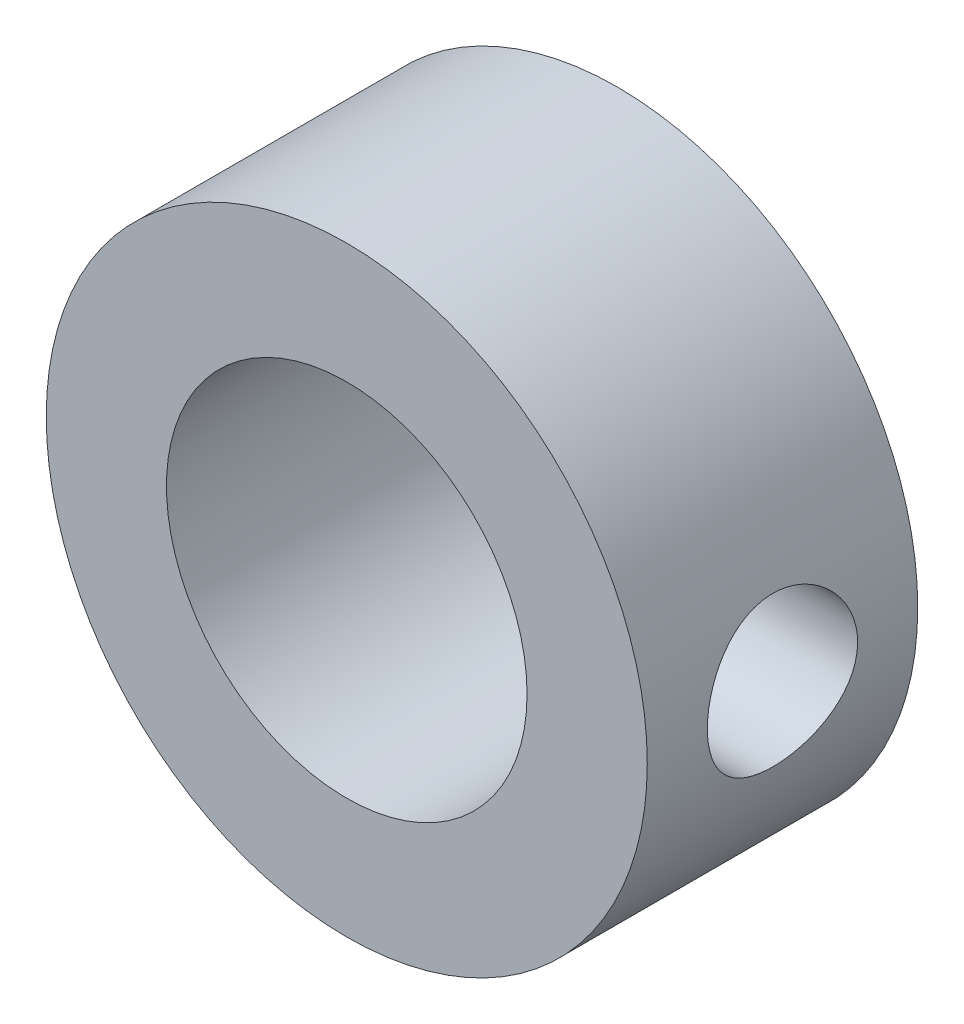
from build123d import *

# Parameters (mm, degrees)
CROQUIS1_W            = 14.288
CROQUIS1_H            = 15.875
CORTAR_EXTRUIR1_REACH = 28.612
CROQUIS2_R            = 9.525
CROQUIS3_W            = 3.96875
CROQUIS3_H            = 15.875


with BuildPart() as part:
    # Croquis1 → Revolución1 (revolve)
    with BuildSketch(Plane(origin=(0, 0, 0), x_dir=(0, 0, -1), z_dir=(1, 0, 0)), mode=Mode.PRIVATE) as revoluci_n1_sk:
        with Locations((7.144, 7.9375)):
            Rectangle(CROQUIS1_W, CROQUIS1_H)
    revolve(revoluci_n1_sk.sketch.rotate(Axis((0, 0, 0), (0, 0, -1)), 90), axis=Axis((0, 0, 0), (0, 0, -1)))

    # Croquis2 → Cortar-Extruir1 (cut, up to next)
    with BuildSketch(Plane.XY, mode=Mode.PRIVATE) as cortar_extruir1_sk1:
        Circle(CROQUIS2_R)
    cortar_extruir1_tool1 = extrude(cortar_extruir1_sk1.sketch, amount=-CORTAR_EXTRUIR1_REACH, mode=Mode.PRIVATE) & part.part
    add(cortar_extruir1_tool1.solids().sort_by_distance((0, 0, 0))[0], mode=Mode.SUBTRACT)

    # Croquis3 → Taladro roscado 1/8-27 NPSM1 (revolve, cut)
    with BuildSketch(Plane(origin=(15.875, 0, -7.144), x_dir=(0, 0, -1), z_dir=(0, 1, 0))):
        with Locations((1.984375, 7.9375)):
            Rectangle(CROQUIS3_W, CROQUIS3_H)
    revolve(axis=Axis((22.225, 0, -7.144), (-1, 0, 0)), mode=Mode.SUBTRACT)


solid = part.part
